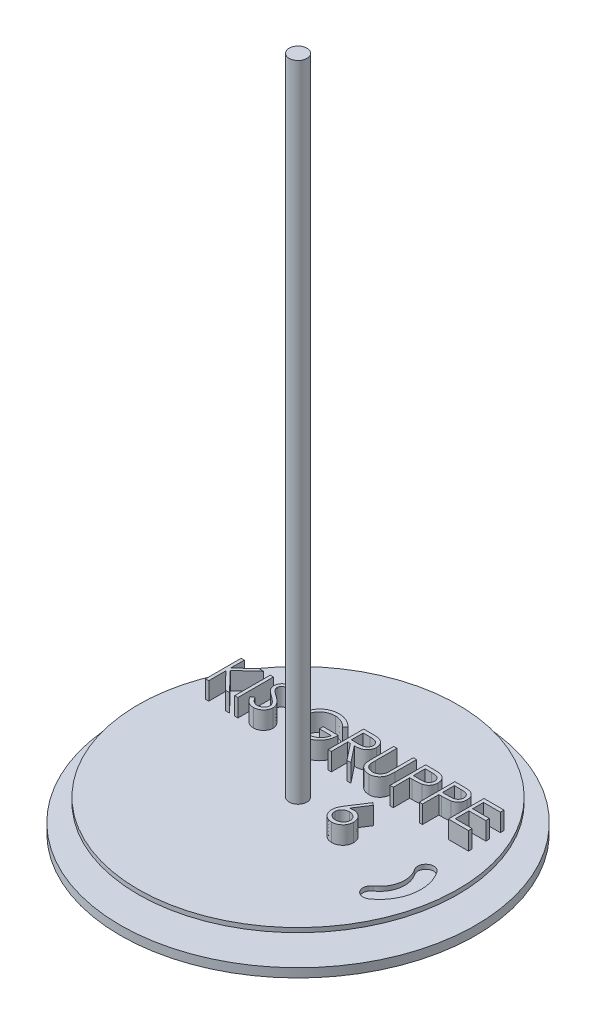
from build123d import *

# Parameters (mm, degrees)
SKETCH1_R           = 200
BOSS_EXTRUDE1_DEPTH = 10
SKETCH2_R           = 10
BOSS_EXTRUDE2_DEPTH = 750
SKETCH3_R           = 180
BOSS_EXTRUDE3_DEPTH = 5
CUT_EXTRUDE1_REACH  = 780.219
SKETCH7_W           = 3.58974359
SKETCH7_H           = 40
BOSS_EXTRUDE5_DEPTH = 20


with BuildPart() as part:
    # Sketch1 → Boss-Extrude1 (new body)
    with BuildSketch(Plane(origin=(0, 0, 0), x_dir=(1, 0, 0), z_dir=(0, 1, 0))):
        with Locations(Location((0, 0, 0), (0, 0, 270))):
            Circle(SKETCH1_R)
    extrude(amount=BOSS_EXTRUDE1_DEPTH)

    # Sketch2 → Boss-Extrude2 (add)
    with BuildSketch(Plane(origin=(0, 10, 0), x_dir=(1, 0, 0), z_dir=(0, 1, 0))):
        with Locations(Location((0, 0, 0), (0, 0, 270))):
            Circle(SKETCH2_R)
    extrude(amount=BOSS_EXTRUDE2_DEPTH)

    # Sketch3 → Boss-Extrude3 (add)
    with BuildSketch(Plane(origin=(0, 30, 0), x_dir=(1, 0, 0), z_dir=(0, 1, 0))):
        with Locations(Location((0, 0, 0), (0, 0, 270))):
            Circle(SKETCH3_R)
    extrude(amount=BOSS_EXTRUDE3_DEPTH)

    # Sketch4 → Cut-Extrude1 (cut, up to next)
    with BuildSketch(Plane(origin=(0, 35, 0), x_dir=(1, 0, 0), z_dir=(0, 1, 0)), mode=Mode.PRIVATE) as cut_extrude1_sk1:
        with BuildLine():
            ThreePointArc((139.15615262, -59.374096223), (158.561909909, -29.632983442), (151.253709954, 5.119101659))
            ThreePointArc((151.253709954, 5.119101659), (138.651621964, 7.482986332), (136.28773729, -5.119101659))
            ThreePointArc((136.28773729, -5.119101659), (140.739866158, -26.289945677), (128.917949302, -44.408123559))
            ThreePointArc((128.917949302, -44.408123559), (126.554064629, -57.01021155), (139.15615262, -59.374096223))
        make_face()
    cut_extrude1_tool1 = extrude(cut_extrude1_sk1.sketch, amount=-CUT_EXTRUDE1_REACH, mode=Mode.PRIVATE) & part.part
    add(cut_extrude1_tool1.solids().sort_by_distance((144.607967, 35, 27.015519))[0], mode=Mode.SUBTRACT)

    # Sketch7 → Boss-Extrude5 (add)
    # profile 1 of 10: a face of its own
    with BuildSketch(Plane(origin=(0, 35, 0), x_dir=(1, 0, 0), z_dir=(0, 1, 0))):
        Polygon((-147.282540226, 83.198052774), (-143.692796636, 83.198052774), (-143.692796636, 67.965680979), (-127.018117149, 83.198052774), (-121.897924841, 83.198052774), (-141.553373559, 65.249334825), (-120.359463302, 43.198052774), (-125.143117149, 43.198052774), (-143.692796636, 62.500937389), (-143.692796636, 43.198052774), (-147.282540226, 43.198052774), align=None)
    # profile 2 of 10: a face of its own
    with BuildSketch(Plane(origin=(0, 35, 0), x_dir=(1, 0, 0), z_dir=(0, 1, 0))):
        with Locations((-112.66715561, 63.198052774)):
            Rectangle(SKETCH7_W, SKETCH7_H)
    # profile 3 of 10: a face of its own
    with BuildSketch(Plane(origin=(0, 35, 0), x_dir=(1, 0, 0), z_dir=(0, 1, 0))):
        with BuildLine():
            Line((-104.718437661, 50.914398928), (-101.337027405, 52.941642517))
            add(Edge.make_bspline(
                [(-101.337027405, 52.941642517), (-101.022533265, 52.415192404), (-100.419974629, 51.406534302), (-99.414816239, 50.043585268), (-98.373297254, 48.88516062), (-97.287704871, 47.937999391), (-96.164665464, 47.192297828), (-94.996847707, 46.664272322), (-93.788187013, 46.33494689), (-92.965629053, 46.2949459), (-92.554976123, 46.274975851)],
                knots=[0, 0, 0, 0, 1.272034388, 2.437168799, 3.508375237, 4.49857839, 5.41946034, 6.295179144, 7.148887113, 8, 8, 8, 8], degree=3))
            add(Edge.make_bspline(
                [(-92.554976123, 46.274975851), (-92.204269146, 46.284743537), (-91.508991739, 46.304107997), (-90.485423248, 46.490174306), (-89.491345508, 46.776027208), (-88.547246791, 47.185409282), (-87.666154054, 47.680706262), (-86.893506107, 48.27894829), (-86.225550528, 48.948733499), (-85.679160647, 49.695963837), (-85.259960244, 50.499588393), (-84.937765176, 51.324456408), (-84.758964335, 52.18352576), (-84.732030009, 52.76193105), (-84.718437661, 53.053822005)],
                knots=[0, 0, 0, 0, 1.095163259, 2.171163733, 3.241058638, 4.321873601, 5.38011039, 6.391990106, 7.366004449, 8.327778327, 9.272591725, 10.192022065, 11.087607919, 12, 12, 12, 12], degree=3))
            add(Edge.make_bspline(
                [(-84.718437661, 53.053822005), (-84.735286927, 53.386860287), (-84.76953902, 54.063878449), (-85.05904165, 55.062731625), (-85.514461614, 56.05121814), (-85.934606113, 56.662661175), (-86.152732533, 56.980104056)],
                knots=[0, 0, 0, 0, 0.938893495, 1.908633276, 2.914225137, 4, 4, 4, 4], degree=3))
            add(Edge.make_bspline(
                [(-86.152732533, 56.980104056), (-86.331825267, 57.209210611), (-86.707808059, 57.690191166), (-87.354179631, 58.406136715), (-88.112649509, 59.144632931), (-88.957261565, 59.933879296), (-89.91878258, 60.737168401), (-90.967097031, 61.592805864), (-92.128969705, 62.468252458), (-92.943821094, 63.055367493), (-93.364270995, 63.358309184)],
                knots=[0, 0, 0, 0, 0.722233717, 1.516239348, 2.393582979, 3.351407094, 4.387010283, 5.505090956, 6.712668013, 8, 8, 8, 8], degree=3))
            add(Edge.make_bspline(
                [(-93.364270995, 63.358309184), (-93.785116665, 63.658064471), (-94.589741541, 64.231173754), (-95.714982482, 65.081737), (-96.721204916, 65.859381223), (-97.603936534, 66.571427076), (-98.362789069, 67.21797113), (-99.003742338, 67.79280472), (-99.510468704, 68.311473987), (-99.792246769, 68.647946464), (-99.918758174, 68.799014312)],
                knots=[0, 0, 0, 0, 1.452282411, 2.77665338, 3.964542531, 5.026858415, 5.96415736, 6.766646006, 7.446254459, 8, 8, 8, 8], degree=3))
            add(Edge.make_bspline(
                [(-99.918758174, 68.799014312), (-100.095587263, 69.034454733), (-100.443345397, 69.497479919), (-100.902385459, 70.22119258), (-101.29254732, 70.962029899), (-101.598402544, 71.721982636), (-101.855959331, 72.490381824), (-102.029192825, 73.277253203), (-102.137665932, 74.079065985), (-102.14877435, 74.61864885), (-102.154335097, 74.888757902)],
                knots=[0, 0, 0, 0, 1.068054152, 2.10047183, 3.106115577, 4.101338837, 5.06977816, 6.043150881, 7.020423561, 8, 8, 8, 8], degree=3))
            add(Edge.make_bspline(
                [(-102.154335097, 74.888757902), (-102.139418423, 75.311955326), (-102.109903908, 76.149304625), (-101.860297996, 77.372514116), (-101.466322069, 78.540358884), (-100.914380493, 79.641276984), (-100.202867889, 80.64660248), (-99.379485324, 81.567899474), (-98.398782625, 82.342397557), (-97.322752644, 83.019106795), (-96.144965535, 83.548774512), (-94.910783782, 83.948328571), (-93.618245816, 84.174720087), (-92.74278142, 84.207208829), (-92.298565867, 84.223693799)],
                knots=[0, 0, 0, 0, 1.005424448, 1.989358655, 2.955360095, 3.929531133, 4.905563448, 5.876582895, 6.856512386, 7.866279853, 8.892233794, 9.918561126, 10.94386622, 12, 12, 12, 12], degree=3))
            add(Edge.make_bspline(
                [(-92.298565867, 84.223693799), (-91.82720472, 84.207436067), (-90.889817843, 84.175104626), (-89.510969665, 83.893989982), (-88.183418621, 83.428839447), (-87.115495594, 82.90096907), (-86.279692606, 82.373752891), (-85.642289947, 81.893526328), (-84.996376223, 81.340667944), (-84.336741311, 80.713705131), (-83.674562346, 80.006885119), (-83.000008606, 79.225048674), (-82.311502677, 78.37297375), (-81.868578561, 77.764693741), (-81.641514585, 77.452860466)],
                knots=[0, 0, 0, 0, 1.286793592, 2.559021753, 3.825965368, 5.121522368, 5.803751409, 6.523245864, 7.299691795, 8.125521123, 9.008227632, 9.944561021, 10.946284179, 12, 12, 12, 12], degree=3))
            Line((-81.641514585, 77.452860466), (-84.886706892, 74.992924569))
            add(Edge.make_bspline(
                [(-84.886706892, 74.992924569), (-85.082660406, 75.245366745), (-85.460021058, 75.731511353), (-86.03292948, 76.412326389), (-86.572914027, 77.034229012), (-87.104918596, 77.574401904), (-87.600845813, 78.062426285), (-88.082183439, 78.480252077), (-88.542004596, 78.831973168), (-89.121626432, 79.207328139), (-89.849828927, 79.579402465), (-90.763937912, 79.894249071), (-91.719209627, 80.083449779), (-92.369833987, 80.108465637), (-92.699206892, 80.121129697)],
                knots=[0, 0, 0, 0, 1.181633172, 2.275549214, 3.290209073, 4.226197932, 5.078386478, 5.862611352, 6.581680152, 7.217281963, 8.414376989, 9.595101626, 10.782541182, 12, 12, 12, 12], degree=3))
            add(Edge.make_bspline(
                [(-92.699206892, 80.121129697), (-93.112424291, 80.107281697), (-93.909275119, 80.080577135), (-95.040592103, 79.78892016), (-96.058808389, 79.3296989), (-96.933694847, 78.68609915), (-97.662117442, 77.923573519), (-98.189036971, 77.04610089), (-98.506181708, 76.077159146), (-98.544882047, 75.401254502), (-98.564591508, 75.057027133)],
                knots=[0, 0, 0, 0, 1.14458467, 2.207223713, 3.21896685, 4.227309161, 5.202851033, 6.127160689, 7.046193047, 8, 8, 8, 8], degree=3))
            add(Edge.make_bspline(
                [(-98.564591508, 75.057027133), (-98.560098632, 74.842724521), (-98.551105533, 74.41376887), (-98.425679274, 73.780038334), (-98.264544086, 73.14790874), (-98.009199723, 72.520222079), (-97.656681968, 71.886000833), (-97.193765671, 71.234323832), (-96.610756391, 70.559447162), (-96.164161964, 70.120505747), (-95.928373559, 69.888757902)],
                knots=[0, 0, 0, 0, 0.858281714, 1.717966888, 2.583508476, 3.4729293, 4.427298488, 5.488583878, 6.674047936, 8, 8, 8, 8], degree=3))
            add(Edge.make_bspline(
                [(-95.928373559, 69.888757902), (-95.840815017, 69.810620464), (-95.632795964, 69.624983797), (-95.25249967, 69.321072019), (-94.750296262, 68.946183192), (-94.139299677, 68.482328147), (-93.408244114, 67.944254294), (-92.557049187, 67.338841584), (-91.595203097, 66.646436338), (-90.912666915, 66.16235016), (-90.551770995, 65.906386107)],
                knots=[0, 0, 0, 0, 0.420754252, 0.999615792, 1.744751191, 2.668019286, 3.750313428, 4.999500688, 6.413464383, 8, 8, 8, 8], degree=3))
            add(Edge.make_bspline(
                [(-90.551770995, 65.906386107), (-90.117646271, 65.590484855), (-89.277023913, 64.978785864), (-88.080937285, 64.05974952), (-86.996436621, 63.16091788), (-86.019714295, 62.288030941), (-85.141121055, 61.447709878), (-84.370404248, 60.62984496), (-83.699710758, 59.840295558), (-82.977662547, 58.82803755), (-82.239858895, 57.584825159), (-81.606241668, 56.06164529), (-81.206717697, 54.532544484), (-81.154471806, 53.50480921), (-81.128694072, 52.997732261)],
                knots=[0, 0, 0, 0, 1.163667725, 2.253281268, 3.268753668, 4.215851969, 5.092017293, 5.902905408, 6.650798638, 7.335211899, 8.59617414, 9.77448103, 10.901945474, 12, 12, 12, 12], degree=3))
            add(Edge.make_bspline(
                [(-81.128694072, 52.997732261), (-81.136204222, 52.639122374), (-81.15107868, 51.928866562), (-81.322060551, 50.885951398), (-81.57257101, 49.873027173), (-81.950139398, 48.902614459), (-82.410975493, 47.956960029), (-82.995732611, 47.060869738), (-83.673534723, 46.194510897), (-84.451063464, 45.380985282), (-85.301873777, 44.634171613), (-86.201116001, 43.969839482), (-87.150261978, 43.415915786), (-88.14416274, 42.963906163), (-89.183046588, 42.610380248), (-90.266564117, 42.354233172), (-91.396501388, 42.197025048), (-92.164506892, 42.180707774), (-92.554976123, 42.172411748)],
                knots=[0, 0, 0, 0, 0.983748083, 1.948392443, 2.894712957, 3.844097841, 4.80183111, 5.778335162, 6.776009319, 7.81870978, 8.863265674, 9.881300176, 10.883814829, 11.87499822, 12.874611388, 13.892143829, 14.928324115, 16, 16, 16, 16], degree=3))
            add(Edge.make_bspline(
                [(-92.554976123, 42.172411748), (-92.857094328, 42.178253824), (-93.457525872, 42.189864399), (-94.345634236, 42.292507604), (-95.21580097, 42.437731645), (-96.05710705, 42.668292445), (-96.880391755, 42.948029325), (-97.682074435, 43.292467412), (-98.462543622, 43.705235429), (-99.226173141, 44.177178567), (-99.97102085, 44.726409934), (-100.690100484, 45.366107036), (-101.407005461, 46.078627093), (-102.100575705, 46.883319246), (-102.784840211, 47.76718305), (-103.446307748, 48.738488003), (-104.098670236, 49.791943475), (-104.507989868, 50.53325874), (-104.718437661, 50.914398928)],
                knots=[0, 0, 0, 0, 0.915332311, 1.819136955, 2.706846663, 3.586547465, 4.459518054, 5.340707479, 6.227863349, 7.133153174, 8.059268498, 9.028702269, 10.047606654, 11.120612155, 12.245963614, 13.433783089, 14.680604001, 16, 16, 16, 16], degree=3))
        make_face()
    # profile 4 of 10: a face of its own
    with BuildSketch(Plane(origin=(0, 35, 0), x_dir=(1, 0, 0), z_dir=(0, 1, 0))):
        with BuildLine():
            Line((-20.103053046, 76.371129697), (-23.179976123, 73.45446303))
            add(Edge.make_bspline(
                [(-23.179976123, 73.45446303), (-23.736763416, 73.978244322), (-24.83706109, 75.013317041), (-26.630892435, 76.356299842), (-28.502476823, 77.506769558), (-30.442048216, 78.442840832), (-32.401574547, 79.189729524), (-34.355046275, 79.721479697), (-36.282425719, 80.060594411), (-37.564336787, 80.101147204), (-38.196001764, 80.121129697)],
                knots=[0, 0, 0, 0, 1.08915593, 2.152340314, 3.188132944, 4.216796309, 5.218260357, 6.173443236, 7.099959455, 8, 8, 8, 8], degree=3))
            add(Edge.make_bspline(
                [(-38.196001764, 80.121129697), (-38.583598335, 80.116402772), (-39.357786227, 80.106961183), (-40.507751302, 79.986455865), (-41.645655725, 79.813143134), (-42.769351437, 79.562378817), (-43.881023281, 79.244560994), (-44.976804906, 78.847012843), (-46.058740389, 78.383524337), (-47.116638458, 77.847953209), (-48.142244213, 77.259612107), (-49.110893763, 76.607628786), (-50.028761179, 75.912899759), (-50.878594611, 75.158031422), (-51.665282459, 74.349861532), (-52.407549566, 73.503423748), (-53.079290091, 72.595592679), (-53.686046262, 71.643071238), (-54.227321901, 70.662589075), (-54.705135084, 69.663583479), (-55.106244663, 68.649368), (-55.423609866, 67.61866997), (-55.685445911, 66.579463228), (-55.869647135, 65.524552137), (-55.973495389, 64.452807161), (-55.991458589, 63.735124208), (-56.000488943, 63.374334825)],
                knots=[0, 0, 0, 0, 1.02818874, 2.053710826, 3.065248034, 4.081641283, 5.106893873, 6.131558223, 7.173050175, 8.228653731, 9.27666206, 10.308777013, 11.325269123, 12.329503258, 13.32196095, 14.316845687, 15.314881793, 16.315733098, 17.311955233, 18.285320748, 19.252783886, 20.203351036, 21.145449891, 22.095197417, 23.042428769, 24, 24, 24, 24], degree=3))
            add(Edge.make_bspline(
                [(-56.000488943, 63.374334825), (-55.991852163, 63.005525485), (-55.974602187, 62.268913902), (-55.864198535, 61.169553072), (-55.659304358, 60.086519901), (-55.385387686, 59.016255524), (-55.042749792, 57.956926976), (-54.615633608, 56.913126863), (-54.109741031, 55.884893821), (-53.524180437, 54.881492485), (-52.882052397, 53.904086504), (-52.1627029, 52.983406255), (-51.398581946, 52.107191658), (-50.561851662, 51.294897214), (-49.679342608, 50.524795542), (-48.724688025, 49.818103863), (-47.716659906, 49.161209883), (-46.653720341, 48.562392519), (-45.547402828, 48.027437825), (-44.413039935, 47.551736155), (-43.247007757, 47.1599723), (-42.055434161, 46.840679683), (-40.839739627, 46.578962001), (-39.593753311, 46.410590797), (-38.326636643, 46.288409872), (-37.472480848, 46.2794765), (-37.04215561, 46.274975851)],
                knots=[0, 0, 0, 0, 0.93586088, 1.869166235, 2.799637598, 3.729985548, 4.670839027, 5.622275134, 6.589130586, 7.576015415, 8.568469353, 9.55398029, 10.53834874, 11.515998671, 12.510579167, 13.508179873, 14.527009472, 15.561807829, 16.601455013, 17.643573243, 18.680854198, 19.719860599, 20.772568776, 21.833555941, 22.908541556, 24, 24, 24, 24], degree=3))
            add(Edge.make_bspline(
                [(-37.04215561, 46.274975851), (-36.523545927, 46.285816723), (-35.505171559, 46.307104537), (-34.008183642, 46.47282213), (-32.570434262, 46.731642629), (-31.195963368, 47.110681448), (-29.88317456, 47.594152019), (-28.627255231, 48.176956436), (-27.438093417, 48.88144854), (-26.312114291, 49.676578449), (-25.274889314, 50.562462249), (-24.33941361, 51.518398879), (-23.520608019, 52.539748213), (-22.806268599, 53.620494673), (-22.215312549, 54.769583873), (-21.730252034, 55.981384587), (-21.358442987, 57.256441866), (-21.205814703, 58.137489086), (-21.128694072, 58.582668158)],
                knots=[0, 0, 0, 0, 1.13008108, 2.219097802, 3.278683437, 4.311054135, 5.322181354, 6.324827112, 7.324222904, 8.330512327, 9.32562643, 10.293043162, 11.24128371, 12.174520618, 13.111833804, 14.052305215, 15.015860969, 16, 16, 16, 16], degree=3))
            Line((-21.128694072, 58.582668158), (-34.462027405, 58.582668158))
            Line((-34.462027405, 58.582668158), (-34.462027405, 62.685232261))
            Line((-34.462027405, 62.685232261), (-17.538950482, 62.685232261))
            add(Edge.make_bspline(
                [(-17.538950482, 62.685232261), (-17.558445892, 61.920575246), (-17.596601931, 60.42400334), (-17.864246681, 58.241485959), (-18.296435393, 56.180095178), (-18.886838957, 54.237660074), (-19.651127875, 52.416933299), (-20.581099629, 50.716066258), (-21.691638155, 49.146047048), (-22.943186058, 47.694058435), (-24.347757004, 46.398867439), (-25.867398375, 45.260513862), (-27.504620871, 44.30162683), (-29.257875814, 43.521504974), (-31.121423624, 42.912659318), (-33.099576536, 42.480984155), (-35.189651972, 42.222356003), (-36.622071137, 42.189311667), (-37.35465561, 42.172411748)],
                knots=[0, 0, 0, 0, 1.140356446, 2.231883559, 3.274166699, 4.278491846, 5.25512956, 6.21435461, 7.1637429, 8.11826594, 9.068280886, 10.0076534, 10.945064095, 11.891975133, 12.864533718, 13.863980011, 14.907571808, 16, 16, 16, 16], degree=3))
            add(Edge.make_bspline(
                [(-37.35465561, 42.172411748), (-37.806200014, 42.178915991), (-38.69679111, 42.191744454), (-40.012116002, 42.282914138), (-41.291174523, 42.423263582), (-42.533780339, 42.63520785), (-43.744504249, 42.894803898), (-44.917299506, 43.227223541), (-46.0566337, 43.612008676), (-47.164267822, 44.049673516), (-48.230148357, 44.556778164), (-49.259022836, 45.120316901), (-50.256578559, 45.737383881), (-51.216020445, 46.418650689), (-52.142347547, 47.159021662), (-53.029586903, 47.959980736), (-53.882705509, 48.819079248), (-54.417110807, 49.429125072), (-54.686386379, 49.736514312)],
                knots=[0, 0, 0, 0, 1.107784379, 2.184907829, 3.233506516, 4.263428166, 5.276301166, 6.270063455, 7.25232949, 8.225834625, 9.190232166, 10.146266622, 11.1027726, 12.066435141, 13.031522626, 14.010570082, 14.99756817, 16, 16, 16, 16], degree=3))
            add(Edge.make_bspline(
                [(-54.686386379, 49.736514312), (-55.077082744, 50.224178918), (-55.851990317, 51.1914134), (-56.849454964, 52.741127051), (-57.699756711, 54.345719738), (-58.389674678, 56.009658348), (-58.928395665, 57.731386495), (-59.314752839, 59.508704109), (-59.541121859, 61.343899886), (-59.573733715, 62.585788625), (-59.590232533, 63.214078415)],
                knots=[0, 0, 0, 0, 1.023165419, 2.029347347, 3.013907458, 3.994755782, 4.975994455, 5.96558838, 6.970761222, 8, 8, 8, 8], degree=3))
            add(Edge.make_bspline(
                [(-59.590232533, 63.214078415), (-59.584149812, 63.684549874), (-59.572061676, 64.619513388), (-59.425484349, 66.007596902), (-59.215182429, 67.371033383), (-58.906073233, 68.708708312), (-58.516401637, 70.021515075), (-58.030076082, 71.310063234), (-57.4638487, 72.575113195), (-56.805728744, 73.807957401), (-56.073334921, 74.992236404), (-55.27847526, 76.123182728), (-54.409862686, 77.180200614), (-53.48168212, 78.176676594), (-52.482859375, 79.100091988), (-51.422751676, 79.95899611), (-50.300542043, 80.754541091), (-49.112699986, 81.474196345), (-47.876955021, 82.120637722), (-46.59626929, 82.68737157), (-45.271033737, 83.155752318), (-43.911176849, 83.553166942), (-42.506405414, 83.847054263), (-41.066913563, 84.060182782), (-39.585197998, 84.206018207), (-38.583643377, 84.217746845), (-38.075809456, 84.223693799)],
                knots=[0, 0, 0, 0, 1.008945113, 2.00506715, 2.99143336, 3.967273523, 4.948097931, 5.927297278, 6.919902385, 7.919676788, 8.923139349, 9.905703106, 10.883022732, 11.856032218, 12.825136022, 13.798837087, 14.781400844, 15.773989409, 16.776158564, 17.77167057, 18.775803737, 19.789618931, 20.80898985, 21.851988756, 22.910860228, 24, 24, 24, 24], degree=3))
            add(Edge.make_bspline(
                [(-38.075809456, 84.223693799), (-37.6616581, 84.217071037), (-36.840444629, 84.203938876), (-35.61843626, 84.112914327), (-34.415316092, 83.9686414), (-33.229300208, 83.771763839), (-32.064427451, 83.503607376), (-30.917379389, 83.182712694), (-29.786493261, 82.809091865), (-28.67531327, 82.363505049), (-27.576367944, 81.857749336), (-26.48354691, 81.28845308), (-25.400584099, 80.645881598), (-24.325601454, 79.928126907), (-23.251820221, 79.147516417), (-22.196224308, 78.281724147), (-21.133333517, 77.364892651), (-20.449884211, 76.705667692), (-20.103053046, 76.371129697)],
                knots=[0, 0, 0, 0, 0.985871117, 1.954866573, 2.915460327, 3.869826059, 4.81536089, 5.759505086, 6.70452669, 7.649098992, 8.607881297, 9.583363685, 10.581137262, 11.603961102, 12.659522466, 13.73993555, 14.853081303, 16, 16, 16, 16], degree=3))
        make_face()
    # profile 5 of 10: a face of its own
    with BuildSketch(Plane(origin=(0, 35, 0), x_dir=(1, 0, 0), z_dir=(0, 1, 0))):
        with BuildLine():
            Line((-9.333822277, 83.198052774), (-1.329014585, 83.198052774))
            add(Edge.make_bspline(
                [(-1.329014585, 83.198052774), (-0.794830259, 83.196274648), (0.23086282, 83.19286045), (1.700271624, 83.17382316), (3.035438447, 83.119259094), (4.235665182, 83.072303855), (5.300929811, 82.986681668), (6.234498848, 82.904845701), (7.032072533, 82.797718149), (7.514882263, 82.698227601), (7.733485415, 82.653180979)],
                knots=[0, 0, 0, 0, 1.410062039, 2.707475311, 3.878576406, 4.937260626, 5.877586885, 6.699081471, 7.410979367, 8, 8, 8, 8], degree=3))
            add(Edge.make_bspline(
                [(7.733485415, 82.653180979), (8.026132548, 82.580875089), (8.605183857, 82.43780579), (9.438898897, 82.135410352), (10.233348314, 81.785471785), (10.98523202, 81.374457839), (11.69078392, 80.899317499), (12.3572789, 80.368253243), (12.987741339, 79.784170891), (13.556674255, 79.132344131), (14.09312056, 78.448498306), (14.545562006, 77.7090268), (14.935578917, 76.935752199), (15.246099111, 76.120810282), (15.496133094, 75.272104318), (15.672432972, 74.381946641), (15.778160831, 73.45439264), (15.788924894, 72.821730825), (15.794382851, 72.500937389)],
                knots=[0, 0, 0, 0, 1.027469482, 2.033020251, 3.019912614, 3.986113645, 4.951240523, 5.91722682, 6.890402269, 7.87763091, 8.8651537, 9.85103654, 10.82876324, 11.815024772, 12.821070561, 13.842952187, 14.906261191, 16, 16, 16, 16], degree=3))
            add(Edge.make_bspline(
                [(15.794382851, 72.500937389), (15.777594302, 71.967964765), (15.744835493, 70.927997132), (15.439405736, 69.418729916), (14.939102654, 68.010852034), (14.249693636, 66.706136172), (13.371756771, 65.530014511), (12.316616301, 64.496980736), (11.083683599, 63.632524592), (9.935919988, 63.033063967), (8.92204342, 62.649145011), (8.087376988, 62.379015196), (7.176897245, 62.170307021), (6.199327707, 61.983334087), (5.150600215, 61.842171865), (4.033228337, 61.738782214), (2.846415175, 61.674164515), (2.031111526, 61.664541601), (1.611690544, 61.659591235)],
                knots=[0, 0, 0, 0, 1.260483769, 2.459530307, 3.627416485, 4.787058657, 5.939039949, 7.08810263, 8.267026773, 9.491475466, 10.141966685, 10.831826277, 11.566392101, 12.351337768, 13.187381173, 14.07005841, 15.007169909, 16, 16, 16, 16], degree=3))
            Line((1.611690544, 61.659591235), (16.307203364, 43.198052774))
            Line((16.307203364, 43.198052774), (11.8681008, 43.198052774))
            Line((11.8681008, 43.198052774), (-2.82741202, 61.659591235))
            Line((-2.82741202, 61.659591235), (-5.744078687, 61.659591235))
            Line((-5.744078687, 61.659591235), (-5.744078687, 43.198052774))
            Line((-5.744078687, 43.198052774), (-9.333822277, 43.198052774))
            Line((-9.333822277, 43.198052774), (-9.333822277, 83.198052774))
        make_face()
        with BuildLine():
            Line((-5.744078687, 79.095488671), (-5.744078687, 65.762155338))
            Line((-5.744078687, 65.762155338), (1.579639262, 65.706065594))
            add(Edge.make_bspline(
                [(1.579639262, 65.706065594), (1.921582564, 65.705914318), (2.584366074, 65.705621102), (3.543230814, 65.751264259), (4.436032091, 65.803187896), (5.259354973, 65.882608988), (6.013567262, 65.984964094), (6.698291985, 66.112998199), (7.314646863, 66.262164629), (8.033487302, 66.493040353), (8.836190518, 66.858823419), (9.708550059, 67.391000547), (10.451433919, 68.060361909), (11.079066631, 68.825772835), (11.583402991, 69.667329964), (11.938969326, 70.574945613), (12.164597238, 71.525706733), (12.191209186, 72.179170822), (12.204639262, 72.50895021)],
                knots=[0, 0, 0, 0, 1.146690395, 2.22261258, 3.21895312, 4.145990853, 4.996080663, 5.770904154, 6.481378293, 7.121626537, 8.300444488, 9.431385265, 10.535395872, 11.636531494, 12.74115979, 13.810798291, 14.895190096, 16, 16, 16, 16], degree=3))
            add(Edge.make_bspline(
                [(12.204639262, 72.50895021), (12.190900735, 72.830625338), (12.163675988, 73.468068066), (11.941404348, 74.401278469), (11.565525704, 75.282043613), (11.058985842, 76.106780585), (10.441852642, 76.855417566), (9.718220497, 77.495956458), (8.90787541, 78.024521769), (8.150490286, 78.362286117), (7.473527857, 78.569370154), (6.885760314, 78.715097741), (6.22162914, 78.832177386), (5.477909613, 78.925983796), (4.65777669, 79.00661173), (3.757083534, 79.060917772), (2.781806046, 79.093076219), (2.105841118, 79.094665806), (1.755921313, 79.095488671)],
                knots=[0, 0, 0, 0, 1.101028733, 2.181837193, 3.264309656, 4.369019818, 5.486613113, 6.575447106, 7.666700264, 8.788928104, 9.402425223, 10.0903467, 10.862060571, 11.710948788, 12.657782767, 13.684531032, 14.801375019, 16, 16, 16, 16], degree=3))
            Line((1.755921313, 79.095488671), (-5.744078687, 79.095488671))
        make_face(mode=Mode.SUBTRACT)
    # profile 6 of 10: a face of its own
    with BuildSketch(Plane(origin=(0, 35, 0), x_dir=(1, 0, 0), z_dir=(0, 1, 0))):
        with BuildLine():
            Line((24.512331569, 83.198052774), (28.102075159, 83.198052774))
            Line((28.102075159, 83.198052774), (28.102075159, 59.23170662))
            add(Edge.make_bspline(
                [(28.102075159, 59.23170662), (28.101540942, 58.892498211), (28.100527174, 58.248791801), (28.107298761, 57.332582652), (28.126262971, 56.518040262), (28.138219081, 55.802024862), (28.164817178, 55.187822034), (28.186509143, 54.672104197), (28.214401219, 54.257313312), (28.247922562, 54.015245586), (28.262331569, 53.911193799)],
                knots=[0, 0, 0, 0, 1.528628734, 2.90083645, 4.128790002, 5.200304208, 6.127813768, 6.898992206, 7.526736466, 8, 8, 8, 8], degree=3))
            add(Edge.make_bspline(
                [(28.262331569, 53.911193799), (28.321502527, 53.535802218), (28.436510371, 52.806171028), (28.729611831, 51.767219236), (29.1389547, 50.830859712), (29.624018045, 49.967873528), (30.263247889, 49.202280842), (31.029002578, 48.49700481), (31.956748504, 47.880184186), (32.988298283, 47.316174908), (34.100129569, 46.862859681), (35.236258328, 46.520078374), (36.379606661, 46.311176662), (37.145048547, 46.286987645), (37.525152082, 46.274975851)],
                knots=[0, 0, 0, 0, 1.035780045, 2.013197591, 2.933192213, 3.817615948, 4.702609284, 5.640816605, 6.646850145, 7.73207398, 8.84249596, 9.914020372, 10.964143139, 12, 12, 12, 12], degree=3))
            add(Edge.make_bspline(
                [(37.525152082, 46.274975851), (37.851480544, 46.287248425), (38.50225268, 46.311722691), (39.469183316, 46.463281903), (40.410898844, 46.736431225), (41.332049471, 47.088885607), (42.195489293, 47.554572363), (43.001700059, 48.092524814), (43.721287879, 48.723506254), (44.377950711, 49.421795906), (44.949778549, 50.209679334), (45.445448739, 51.070000912), (45.851459364, 52.015707733), (46.05195679, 52.680329702), (46.154959774, 53.021770722)],
                knots=[0, 0, 0, 0, 0.994687771, 1.983630487, 2.973142513, 3.978332533, 4.983357753, 5.956394766, 6.925816176, 7.893390482, 8.871859704, 9.88551698, 10.913711441, 12, 12, 12, 12], degree=3))
            add(Edge.make_bspline(
                [(46.154959774, 53.021770722), (46.189246921, 53.162897286), (46.2656525, 53.477384144), (46.3370473, 54.009056037), (46.41140759, 54.636363053), (46.463002676, 55.363812343), (46.513302338, 56.188966315), (46.543394599, 57.116123544), (46.557303546, 58.141917381), (46.561448465, 58.857770659), (46.563613621, 59.23170662)],
                knots=[0, 0, 0, 0, 0.558680831, 1.244966039, 2.062412453, 2.990489873, 4.051219941, 5.244515665, 6.560634259, 8, 8, 8, 8], degree=3))
            Line((46.563613621, 59.23170662), (46.563613621, 83.198052774))
            Line((46.563613621, 83.198052774), (50.15335721, 83.198052774))
            Line((50.15335721, 83.198052774), (50.15335721, 59.039398928))
            add(Edge.make_bspline(
                [(50.15335721, 59.039398928), (50.150452977, 58.603988882), (50.14478519, 57.754259706), (50.095635744, 56.509101318), (50.017270032, 55.327924388), (49.906549026, 54.210570142), (49.759840419, 53.161036894), (49.596695042, 52.170125258), (49.38892895, 51.244948199), (49.146261507, 50.378291997), (48.86884953, 49.553314701), (48.50952212, 48.770359105), (48.104670692, 48.005623109), (47.624503231, 47.270673293), (47.084944572, 46.562255543), (46.47406822, 45.884666114), (45.81207781, 45.227077014), (45.087968558, 44.606356258), (44.31367684, 44.037114236), (43.491505896, 43.536568281), (42.627771384, 43.113441224), (41.724718514, 42.765144945), (40.78196191, 42.503263812), (39.799477799, 42.308119174), (38.775029875, 42.197235774), (38.078290947, 42.180756573), (37.725472595, 42.172411748)],
                knots=[0, 0, 0, 0, 1.316592851, 2.569410997, 3.76748051, 4.895814652, 5.963796859, 6.97159953, 7.931736103, 8.829262218, 9.692595152, 10.560224239, 11.431080259, 12.30701507, 13.211635791, 14.121146779, 15.063487852, 16.031507147, 17.00238618, 17.966455255, 18.938106653, 19.907068911, 20.888905087, 21.893141452, 22.933117798, 24, 24, 24, 24], degree=3))
            add(Edge.make_bspline(
                [(37.725472595, 42.172411748), (37.340682851, 42.181380494), (36.585726749, 42.198977141), (35.473291695, 42.299808571), (34.406843737, 42.489733078), (33.375119428, 42.731561006), (32.392165175, 43.065089432), (31.444811525, 43.454782288), (30.549283741, 43.933379548), (29.6910537, 44.465875468), (28.893056486, 45.06501419), (28.160514737, 45.71804475), (27.492219073, 46.414506206), (26.899433972, 47.161938957), (26.372338148, 47.954529894), (25.918278566, 48.794521207), (25.528412919, 49.681587677), (25.32719501, 50.298195681), (25.225472595, 50.609911748)],
                knots=[0, 0, 0, 0, 1.13879206, 2.234305948, 3.301075583, 4.341971843, 5.366689343, 6.369221514, 7.369726634, 8.367512178, 9.355451585, 10.318319045, 11.268648973, 12.207971039, 13.137398894, 14.081662264, 15.030215811, 16, 16, 16, 16], degree=3))
            add(Edge.make_bspline(
                [(25.225472595, 50.609911748), (25.166305073, 50.822855456), (25.0379694, 51.284735101), (24.900537427, 52.049152113), (24.785005065, 52.929322601), (24.676370114, 53.92530681), (24.612267738, 55.037876715), (24.556068438, 56.266550039), (24.511935652, 57.612812458), (24.512195908, 58.550578351), (24.512331569, 59.039398928)],
                knots=[0, 0, 0, 0, 0.625038921, 1.35572334, 2.194682327, 3.136881307, 4.189498639, 5.346923369, 6.617055217, 8, 8, 8, 8], degree=3))
            Line((24.512331569, 59.039398928), (24.512331569, 83.198052774))
        make_face()
    # profile 7 of 10: a face of its own
    with BuildSketch(Plane(origin=(0, 35, 0), x_dir=(1, 0, 0), z_dir=(0, 1, 0))):
        with BuildLine():
            Line((60.409767467, 83.198052774), (68.254318749, 83.198052774))
            add(Edge.make_bspline(
                [(68.254318749, 83.198052774), (68.793871962, 83.197459674), (69.82767988, 83.196323268), (71.310137659, 83.16186903), (72.656534592, 83.115849692), (73.863967517, 83.052056627), (74.936151495, 82.976667024), (75.868234919, 82.870929431), (76.667544134, 82.760526053), (77.146474985, 82.648281407), (77.364895672, 82.597091235)],
                knots=[0, 0, 0, 0, 1.415646017, 2.712440637, 3.8905458, 4.950247383, 5.884950622, 6.709939814, 7.411656543, 8, 8, 8, 8], degree=3))
            add(Edge.make_bspline(
                [(77.364895672, 82.597091235), (77.641393201, 82.521411809), (78.18787294, 82.371836246), (78.975313433, 82.072250835), (79.724500239, 81.71702609), (80.438003764, 81.312181063), (81.107056142, 80.840346044), (81.741639467, 80.320647556), (82.336153527, 79.741086772), (82.887255149, 79.108164031), (83.393367121, 78.432504489), (83.829134924, 77.704021862), (84.194017519, 76.934978394), (84.506969193, 76.12590901), (84.732208672, 75.270019598), (84.901887526, 74.373257171), (85.009586127, 73.435717855), (85.019901119, 72.795033654), (85.025152082, 72.468886107)],
                knots=[0, 0, 0, 0, 0.999701418, 1.975846123, 2.934577507, 3.890451536, 4.834027766, 5.787354733, 6.749476667, 7.726910423, 8.712836071, 9.690891519, 10.682875813, 11.679750201, 12.712814741, 13.765529915, 14.8625177, 16, 16, 16, 16], degree=3))
            add(Edge.make_bspline(
                [(85.025152082, 72.468886107), (85.0203358, 72.13999723), (85.010912417, 71.496503927), (84.897812014, 70.555100634), (84.745466966, 69.655461889), (84.51121494, 68.799582455), (84.204407247, 67.992545079), (83.844498072, 67.222016713), (83.410400582, 66.501106177), (82.911602528, 65.827196262), (82.356727164, 65.199654407), (81.748122156, 64.623028184), (81.088244528, 64.100692888), (80.379191407, 63.631477532), (79.614050277, 63.226262909), (78.804425665, 62.863322281), (77.943280334, 62.558510159), (77.347365889, 62.3981666), (77.044382851, 62.316642517)],
                knots=[0, 0, 0, 0, 1.121902311, 2.195077645, 3.232258892, 4.234102512, 5.217864754, 6.176164875, 7.132989551, 8.084763148, 9.034132444, 9.988522005, 10.94243251, 11.903244335, 12.886203696, 13.894208494, 14.929344452, 16, 16, 16, 16], degree=3))
            add(Edge.make_bspline(
                [(77.044382851, 62.316642517), (76.793784749, 62.263351305), (76.244584436, 62.146560515), (75.340096182, 62.016178151), (74.287006058, 61.904891286), (73.08675143, 61.821449713), (71.740409659, 61.750016931), (70.247252433, 61.693238715), (68.604348694, 61.662040386), (67.458391618, 61.660431325), (66.86008798, 61.659591235)],
                knots=[0, 0, 0, 0, 0.601384939, 1.31797006, 2.144135048, 3.087295005, 4.142315834, 5.309527816, 6.595305764, 8, 8, 8, 8], degree=3))
            Line((66.86008798, 61.659591235), (63.999511057, 61.659591235))
            Line((63.999511057, 61.659591235), (63.999511057, 43.198052774))
            Line((63.999511057, 43.198052774), (60.409767467, 43.198052774))
            Line((60.409767467, 43.198052774), (60.409767467, 83.198052774))
        make_face()
        with BuildLine():
            Line((63.999511057, 79.095488671), (63.999511057, 65.762155338))
            Line((63.999511057, 65.762155338), (71.002716185, 65.674014312))
            add(Edge.make_bspline(
                [(71.002716185, 65.674014312), (71.344658194, 65.673837585), (72.004770193, 65.673496418), (72.95832703, 65.719041829), (73.843004599, 65.771619345), (74.656085461, 65.848601328), (75.397936141, 65.957415699), (76.069793613, 66.067264132), (76.666448275, 66.226182562), (77.364724867, 66.440160495), (78.142820266, 66.805104674), (78.989306535, 67.334817703), (79.706684665, 68.010025797), (80.327465199, 68.769201012), (80.820103804, 69.613762491), (81.180743717, 70.517407483), (81.392642658, 71.47086862), (81.4210563, 72.123304493), (81.435408492, 72.452860466)],
                knots=[0, 0, 0, 0, 1.160613943, 2.240541288, 3.23993089, 4.169200891, 5.011653406, 5.7853311, 6.478053781, 7.106038997, 8.262395093, 9.384106736, 10.481365981, 11.59014053, 12.70357646, 13.786202915, 14.881775077, 16, 16, 16, 16], degree=3))
            add(Edge.make_bspline(
                [(81.435408492, 72.452860466), (81.420978247, 72.774443477), (81.392292704, 73.413710702), (81.17908284, 74.350610823), (80.820804967, 75.244733159), (80.324158172, 76.078711277), (79.721402401, 76.835154751), (79.02083848, 77.492264774), (78.224115494, 78.020512806), (77.482992853, 78.361464596), (76.824693584, 78.569639172), (76.252899757, 78.715294492), (75.607292049, 78.831587135), (74.887660283, 78.925752881), (74.099582181, 79.006363866), (73.236287154, 79.061060749), (72.301045517, 79.093077392), (71.65178185, 79.094665452), (71.315216185, 79.095488671)],
                knots=[0, 0, 0, 0, 1.120700087, 2.227813068, 3.331159281, 4.466773991, 5.599788987, 6.693661531, 7.80175334, 8.91857717, 9.525282508, 10.207424825, 10.974604443, 11.810962634, 12.737642355, 13.736264703, 14.826523623, 16, 16, 16, 16], degree=3))
            Line((71.315216185, 79.095488671), (63.999511057, 79.095488671))
        make_face(mode=Mode.SUBTRACT)
    # profile 8 of 10: a face of its own
    with BuildSketch(Plane(origin=(0, 35, 0), x_dir=(1, 0, 0), z_dir=(0, 1, 0))):
        with BuildLine():
            Line((93.230280287, 83.198052774), (101.074831569, 83.198052774))
            add(Edge.make_bspline(
                [(101.074831569, 83.198052774), (101.614384782, 83.197459674), (102.6481927, 83.196323268), (104.13065048, 83.16186903), (105.477047413, 83.115849692), (106.684480338, 83.052056627), (107.756664316, 82.976667024), (108.688747739, 82.870929431), (109.488056954, 82.760526053), (109.966987805, 82.648281407), (110.185408492, 82.597091235)],
                knots=[0, 0, 0, 0, 1.415646017, 2.712440637, 3.8905458, 4.950247383, 5.884950622, 6.709939814, 7.411656543, 8, 8, 8, 8], degree=3))
            add(Edge.make_bspline(
                [(110.185408492, 82.597091235), (110.461906021, 82.521411809), (111.008385761, 82.371836246), (111.795826254, 82.072250835), (112.545013059, 81.71702609), (113.258516584, 81.312181063), (113.927568962, 80.840346044), (114.562152287, 80.320647556), (115.156666348, 79.741086772), (115.707767969, 79.108164031), (116.213879942, 78.432504489), (116.649647744, 77.704021862), (117.014530339, 76.934978394), (117.327482013, 76.12590901), (117.552721493, 75.270019598), (117.722400347, 74.373257171), (117.830098948, 73.435717855), (117.840413939, 72.795033654), (117.845664903, 72.468886107)],
                knots=[0, 0, 0, 0, 0.999701418, 1.975846123, 2.934577507, 3.890451536, 4.834027766, 5.787354733, 6.749476667, 7.726910423, 8.712836071, 9.690891519, 10.682875813, 11.679750201, 12.712814741, 13.765529915, 14.8625177, 16, 16, 16, 16], degree=3))
            add(Edge.make_bspline(
                [(117.845664903, 72.468886107), (117.84084862, 72.13999723), (117.831425238, 71.496503927), (117.718324834, 70.555100634), (117.565979787, 69.655461889), (117.33172776, 68.799582455), (117.024920068, 67.992545079), (116.665010892, 67.222016713), (116.230913403, 66.501106177), (115.732115349, 65.827196262), (115.177239984, 65.199654407), (114.568634977, 64.623028184), (113.908757348, 64.100692888), (113.199704227, 63.631477532), (112.434563098, 63.226262909), (111.624938486, 62.863322281), (110.763793155, 62.558510159), (110.16787871, 62.3981666), (109.864895672, 62.316642517)],
                knots=[0, 0, 0, 0, 1.121902311, 2.195077645, 3.232258892, 4.234102512, 5.217864754, 6.176164875, 7.132989551, 8.084763148, 9.034132444, 9.988522005, 10.94243251, 11.903244335, 12.886203696, 13.894208494, 14.929344452, 16, 16, 16, 16], degree=3))
            add(Edge.make_bspline(
                [(109.864895672, 62.316642517), (109.614297569, 62.263351305), (109.065097256, 62.146560515), (108.160609003, 62.016178151), (107.107518878, 61.904891286), (105.90726425, 61.821449713), (104.56092248, 61.750016931), (103.067765253, 61.693238715), (101.424861514, 61.662040386), (100.278904439, 61.660431325), (99.6806008, 61.659591235)],
                knots=[0, 0, 0, 0, 0.601384939, 1.31797006, 2.144135048, 3.087295005, 4.142315834, 5.309527816, 6.595305764, 8, 8, 8, 8], degree=3))
            Line((99.6806008, 61.659591235), (96.820023877, 61.659591235))
            Line((96.820023877, 61.659591235), (96.820023877, 43.198052774))
            Line((96.820023877, 43.198052774), (93.230280287, 43.198052774))
            Line((93.230280287, 43.198052774), (93.230280287, 83.198052774))
        make_face()
        with BuildLine():
            Line((96.820023877, 79.095488671), (96.820023877, 65.762155338))
            Line((96.820023877, 65.762155338), (103.823229005, 65.674014312))
            add(Edge.make_bspline(
                [(103.823229005, 65.674014312), (104.165171015, 65.673837585), (104.825283014, 65.673496418), (105.778839851, 65.719041829), (106.66351742, 65.771619345), (107.476598281, 65.848601328), (108.218448961, 65.957415699), (108.890306434, 66.067264132), (109.486961096, 66.226182562), (110.185237687, 66.440160495), (110.963333087, 66.805104674), (111.809819356, 67.334817703), (112.527197486, 68.010025797), (113.14797802, 68.769201012), (113.640616625, 69.613762491), (114.001256537, 70.517407483), (114.213155478, 71.47086862), (114.24156912, 72.123304493), (114.255921313, 72.452860466)],
                knots=[0, 0, 0, 0, 1.160613943, 2.240541288, 3.23993089, 4.169200891, 5.011653406, 5.7853311, 6.478053781, 7.106038997, 8.262395093, 9.384106736, 10.481365981, 11.59014053, 12.70357646, 13.786202915, 14.881775077, 16, 16, 16, 16], degree=3))
            add(Edge.make_bspline(
                [(114.255921313, 72.452860466), (114.241491067, 72.774443477), (114.212805525, 73.413710702), (113.99959566, 74.350610823), (113.641317787, 75.244733159), (113.144670993, 76.078711277), (112.541915222, 76.835154751), (111.841351301, 77.492264774), (111.044628314, 78.020512806), (110.303505674, 78.361464596), (109.645206405, 78.569639172), (109.073412578, 78.715294492), (108.427804869, 78.831587135), (107.708173103, 78.925752881), (106.920095002, 79.006363866), (106.056799974, 79.061060749), (105.121558337, 79.093077392), (104.47229467, 79.094665452), (104.135729005, 79.095488671)],
                knots=[0, 0, 0, 0, 1.120700087, 2.227813068, 3.331159281, 4.466773991, 5.599788987, 6.693661531, 7.80175334, 8.91857717, 9.525282508, 10.207424825, 10.974604443, 11.810962634, 12.737642355, 13.736264703, 14.826523623, 16, 16, 16, 16], degree=3))
            Line((104.135729005, 79.095488671), (96.820023877, 79.095488671))
        make_face(mode=Mode.SUBTRACT)
    # profile 9 of 10: a face of its own
    with BuildSketch(Plane(origin=(0, 35, 0), x_dir=(1, 0, 0), z_dir=(0, 1, 0))):
        Polygon((126.050793108, 83.198052774), (148.614895672, 83.198052774), (148.614895672, 79.095488671), (129.640536698, 79.095488671), (129.640536698, 66.787796364), (148.614895672, 66.787796364), (148.614895672, 62.685232261), (129.640536698, 62.685232261), (129.640536698, 47.300616876), (148.614895672, 47.300616876), (148.614895672, 43.198052774), (126.050793108, 43.198052774), align=None)
    # profile 10 of 10: a face of its own
    with BuildSketch(Plane(origin=(0, 35, 0), x_dir=(1, 0, 0), z_dir=(0, 1, 0))):
        with BuildLine():
            Line((67.589254646, 16.557027133), (70.353677723, 14.385552774))
            Line((70.353677723, 14.385552774), (59.784767467, -1.776306201))
            add(Edge.make_bspline(
                [(59.784767467, -1.776306201), (60.488427775, -1.664147793), (61.860996767, -1.445370138), (63.250321321, -1.409279333), (63.927395672, -1.391690816)],
                knots=[0, 0, 0, 0, 1.025318673, 2, 2, 2, 2], degree=3))
            add(Edge.make_bspline(
                [(63.927395672, -1.391690816), (64.333938487, -1.402617807), (65.134205921, -1.424127263), (66.309140803, -1.589656985), (67.438157214, -1.850515407), (68.51657564, -2.230769761), (69.548266861, -2.716510954), (70.539151388, -3.298669471), (71.470602932, -4.007305818), (72.354616409, -4.798905313), (73.157211808, -5.67567085), (73.8677953, -6.605971841), (74.464672919, -7.588839052), (74.948946309, -8.623774663), (75.325002065, -9.709183343), (75.59914658, -10.843676366), (75.761199069, -12.02803604), (75.783204677, -12.8335009), (75.794382851, -13.242652354)],
                knots=[0, 0, 0, 0, 1.04369286, 2.054478336, 3.041073146, 4.015093852, 4.984733326, 5.965804835, 6.960378782, 7.985147595, 9.009457201, 10.008161701, 10.986880575, 11.956520048, 12.937015923, 13.931873656, 14.949455224, 16, 16, 16, 16], degree=3))
            add(Edge.make_bspline(
                [(75.794382851, -13.242652354), (75.778118796, -13.8024204), (75.746114983, -14.903911439), (75.427214457, -16.508216655), (74.93167566, -18.036588261), (74.223361049, -19.464624505), (73.343562387, -20.790368158), (72.270675613, -21.965059191), (71.042750032, -23.01271676), (69.654329482, -23.888792409), (68.160124177, -24.604255849), (66.590387064, -25.11814433), (64.960362535, -25.434526837), (63.854024157, -25.474190867), (63.294382851, -25.494254919)],
                knots=[0, 0, 0, 0, 1.031375318, 2.029502543, 3.004789286, 3.987476834, 4.960371455, 5.9300674, 6.912260825, 7.929083631, 8.949397511, 9.960523116, 10.96833055, 12, 12, 12, 12], degree=3))
            add(Edge.make_bspline(
                [(63.294382851, -25.494254919), (62.756134844, -25.47678971), (61.689959781, -25.44219419), (60.12158499, -25.134012043), (58.614579077, -24.634502297), (57.179500438, -23.946339114), (55.850122005, -23.077106165), (54.660800446, -22.030680118), (53.617465879, -20.829429089), (52.749184497, -19.473539406), (52.060513275, -18.01651132), (51.544056988, -16.497229533), (51.242385637, -14.921229742), (51.200230701, -13.852873865), (51.178998236, -13.314767739)],
                knots=[0, 0, 0, 0, 1.012016664, 2.004627821, 2.994792927, 3.992885782, 4.990978636, 5.973936114, 6.964471063, 7.975201453, 8.993600317, 9.990122807, 10.98767138, 12, 12, 12, 12], degree=3))
            add(Edge.make_bspline(
                [(51.178998236, -13.314767739), (51.192500465, -12.902829645), (51.220069436, -12.061730765), (51.412565325, -10.78785616), (51.721877266, -9.484415226), (52.068280081, -8.378653014), (52.434287053, -7.472807048), (52.738887505, -6.742481441), (53.118018889, -5.990926319), (53.522286102, -5.192370479), (53.98807889, -4.367394105), (54.494543455, -3.502209311), (55.055682322, -2.610575852), (55.449055611, -2.005499335), (55.650152082, -1.696177995)],
                knots=[0, 0, 0, 0, 1.173818275, 2.396712641, 3.66331629, 4.989737886, 5.693666774, 6.447286557, 7.243889047, 8.091586357, 8.998013824, 9.943181721, 10.948533338, 12, 12, 12, 12], degree=3))
            Line((55.650152082, -1.696177995), (67.589254646, 16.557027133))
        make_face()
        with BuildLine():
            add(Edge.make_bspline(
                [(63.174190544, -5.494254919), (62.869479174, -5.503146846), (62.274289352, -5.520515364), (61.401061756, -5.621375386), (60.574624596, -5.811307564), (59.784028783, -6.053208501), (59.044055036, -6.385814898), (58.349325437, -6.789835457), (57.697153416, -7.265506065), (57.094369967, -7.806087906), (56.547859529, -8.39795114), (56.077218035, -9.031888536), (55.671247748, -9.692622286), (55.341169818, -10.385673054), (55.08414038, -11.110775907), (54.898217513, -11.8645959), (54.794746071, -12.65218797), (54.777531996, -13.186273715), (54.768741826, -13.458998508)],
                knots=[0, 0, 0, 0, 1.129588631, 2.206414736, 3.251139165, 4.268635594, 5.265702196, 6.250456724, 7.242448911, 8.251968645, 9.246821453, 10.222880186, 11.173611482, 12.116736599, 13.062300278, 14.020270554, 14.989073742, 16, 16, 16, 16], degree=3))
            add(Edge.make_bspline(
                [(54.768741826, -13.458998508), (54.775900243, -13.729283993), (54.789936833, -14.25927359), (54.917391917, -15.040292785), (55.112078572, -15.791891738), (55.401683096, -16.510195724), (55.747133246, -17.206153644), (56.203194094, -17.854556907), (56.70852879, -18.49478628), (57.312573743, -19.077660239), (57.960840749, -19.620021658), (58.65342592, -20.094081698), (59.375254033, -20.499637965), (60.136070285, -20.817479081), (60.925080388, -21.078328074), (61.748858148, -21.261887837), (62.607976497, -21.365665277), (63.189941503, -21.382901775), (63.486690544, -21.391690816)],
                knots=[0, 0, 0, 0, 0.989467248, 1.94019797, 2.891935182, 3.827694429, 4.772920941, 5.730924762, 6.725747692, 7.756678648, 8.79901574, 9.819492441, 10.826891316, 11.826466727, 12.835195252, 13.867842842, 14.912794438, 16, 16, 16, 16], degree=3))
            add(Edge.make_bspline(
                [(63.486690544, -21.391690816), (63.783439098, -21.382901086), (64.365403151, -21.365663236), (65.22452841, -21.261895592), (66.048280623, -21.078299616), (66.837383579, -20.817582241), (67.597857077, -20.499255275), (68.319053894, -20.096604763), (69.005089249, -19.617106275), (69.653781815, -19.078587095), (70.255312539, -18.491468787), (70.772767155, -17.860271959), (71.214861249, -17.200913155), (71.574109101, -16.512937271), (71.860523859, -15.791457412), (72.05619777, -15.040409139), (72.183389643, -14.259243128), (72.1974624, -13.729273704), (72.204639262, -13.458998508)],
                knots=[0, 0, 0, 0, 1.087397944, 2.132534446, 3.165364764, 4.174271784, 5.174024072, 6.181601208, 7.194203697, 8.236725232, 9.267838612, 10.269026844, 11.221737037, 12.171628256, 13.107553087, 14.05945871, 15.010357665, 16, 16, 16, 16], degree=3))
            add(Edge.make_bspline(
                [(72.204639262, -13.458998508), (72.198350199, -13.185917926), (72.186006814, -12.649949555), (72.046395973, -11.864948203), (71.852768843, -11.106945847), (71.560391349, -10.380706429), (71.180545124, -9.689095832), (70.717877615, -9.028620393), (70.18264824, -8.394216424), (69.564390644, -7.804927185), (68.891359399, -7.266103437), (68.175752709, -6.790451364), (67.427090153, -6.389023059), (66.646130811, -6.054084748), (65.823926437, -5.812376472), (64.973751132, -5.622053694), (64.084731216, -5.520773492), (63.481569979, -5.503207033), (63.174190544, -5.494254919)],
                knots=[0, 0, 0, 0, 0.978206639, 1.919901502, 2.851605144, 3.780102724, 4.718870031, 5.675451981, 6.667674623, 7.690630536, 8.733308323, 9.756129687, 10.767539656, 11.776269907, 12.797430371, 13.836405707, 14.897401972, 16, 16, 16, 16], degree=3))
        make_face(mode=Mode.SUBTRACT)
    extrude(amount=BOSS_EXTRUDE5_DEPTH)


solid = part.part
